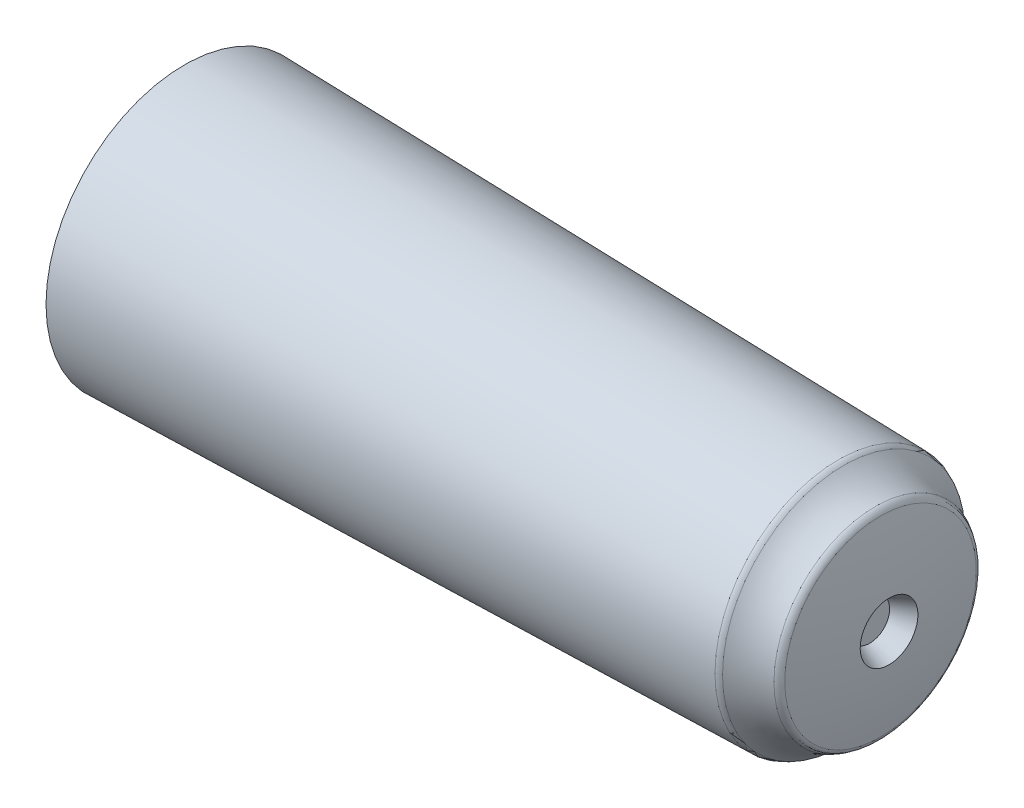
from build123d import *
from build123d.topology import SkipClean

# Parameters (mm, degrees)
RESSALTO_EXTRUS_O1_DEPTH = 0.3
PADR_OCIRCULAR1_COUNT    = 4


with BuildPart() as part:
    # Esboço1 → Revolução1 (revolve)
    with BuildSketch(Plane.XY, mode=Mode.PRIVATE) as revolu_o1_sk:
        with BuildLine():
            Line((64.721381722, 0), (65.721659335, 0))
            Line((65.721659335, 0), (65.721659335, 0.790549355))
            Line((65.721659335, 0.790549355), (66.488086826, 1.147940364))
            ThreePointArc((66.488086826, 1.147940364), (66.363931141, 2.484243424), (66.148816564, 3.808949512))
            ThreePointArc((66.148816564, 3.808949512), (66.078451098, 3.950402062), (65.945979274, 4.036491192))
            ThreePointArc((65.945979274, 4.036491192), (65.267072496, 4.350552288), (64.685513531, 4.821017968))
            ThreePointArc((64.685513531, 4.821017968), (64.59023039, 4.887446395), (64.476855964, 4.912702136))
            ThreePointArc((64.476855964, 4.912702136), (51.470993205, 5.219483812), (38.464666229, 5.505909604))
            Line((38.464666229, 5.505909604), (38.464666229, 4.840384149))
            Line((38.464666229, 4.840384149), (39.289336565, 4.840384149))
            ThreePointArc((39.289336565, 4.840384149), (39.880422623, 4.72038758), (40.470989924, 4.842911726))
            ThreePointArc((40.470989924, 4.842911726), (52.223678048, 4.300405946), (63.985518098, 4.019142166))
            ThreePointArc((63.985518098, 4.019142166), (64.070880078, 4.005598338), (64.148838218, 3.96828036))
            Line((64.148838218, 3.96828036), (65.131851049, 3.308660694))
            ThreePointArc((65.131851049, 3.308660694), (65.216663119, 3.222366511), (65.260488397, 3.109587443))
            Line((65.260488397, 3.109587443), (65.29489544, 2.898871803))
            Line((65.29489544, 2.898871803), (65.439559041, 1.747674044))
            ThreePointArc((65.439559041, 1.747674044), (65.204132456, 1.460485714), (65.003587652, 1.147940364))
            ThreePointArc((65.003587652, 1.147940364), (64.793658929, 0.590890083), (64.721381722, 0))
        make_face()
    revolve(revolu_o1_sk.sketch.rotate(Axis((0, 0, 0), (1, 0, 0)), 90), axis=Axis((0, 0, 0), (1, 0, 0)))

    # Esboço2 → Ressalto-extrusão1 (add, symmetric)
    with SkipClean():  # the faces are left unmerged after this step: merging them gives an invalid solid
        with BuildSketch(Plane.XY):
            with BuildLine():
                ThreePointArc((65.260488397, 3.109587443), (65.216663119, 3.222366511), (65.131851049, 3.308660694))
                Line((65.131851049, 3.308660694), (64.148838218, 3.96828036))
                ThreePointArc((64.148838218, 3.96828036), (64.070880078, 4.005598338), (63.985518098, 4.019142166))
                ThreePointArc((63.985518098, 4.019142166), (58.407998997, 4.119920564), (52.831851049, 4.279450085))
                Line((52.831851049, 4.279450085), (53.789514485, 3.012894518))
                ThreePointArc((53.789514485, 3.012894518), (53.965606904, 2.866804322), (54.188340536, 2.814453436))
                Line((54.188340536, 2.814453436), (60.139559041, 2.814453436))
                Line((60.139559041, 2.814453436), (60.139559041, 1.814453436))
                Line((60.139559041, 1.814453436), (65.439559041, 1.747674044))
                Line((65.439559041, 1.747674044), (65.29489544, 2.898871803))
                Line((65.29489544, 2.898871803), (65.260488397, 3.109587443))
            make_face()
        ressalto_extrus_o1 = extrude(amount=RESSALTO_EXTRUS_O1_DEPTH, both=True)

    # PadrãoCircular1: Ressalto-extrusão1 ×4 about axis
    padr_ocircular1_axis = Axis((0, 0, 0), (1, 0, 0))
    for i in range(1, PADR_OCIRCULAR1_COUNT):
        add(ressalto_extrus_o1.rotate(padr_ocircular1_axis, i * 360 / PADR_OCIRCULAR1_COUNT))


solid = part.part
